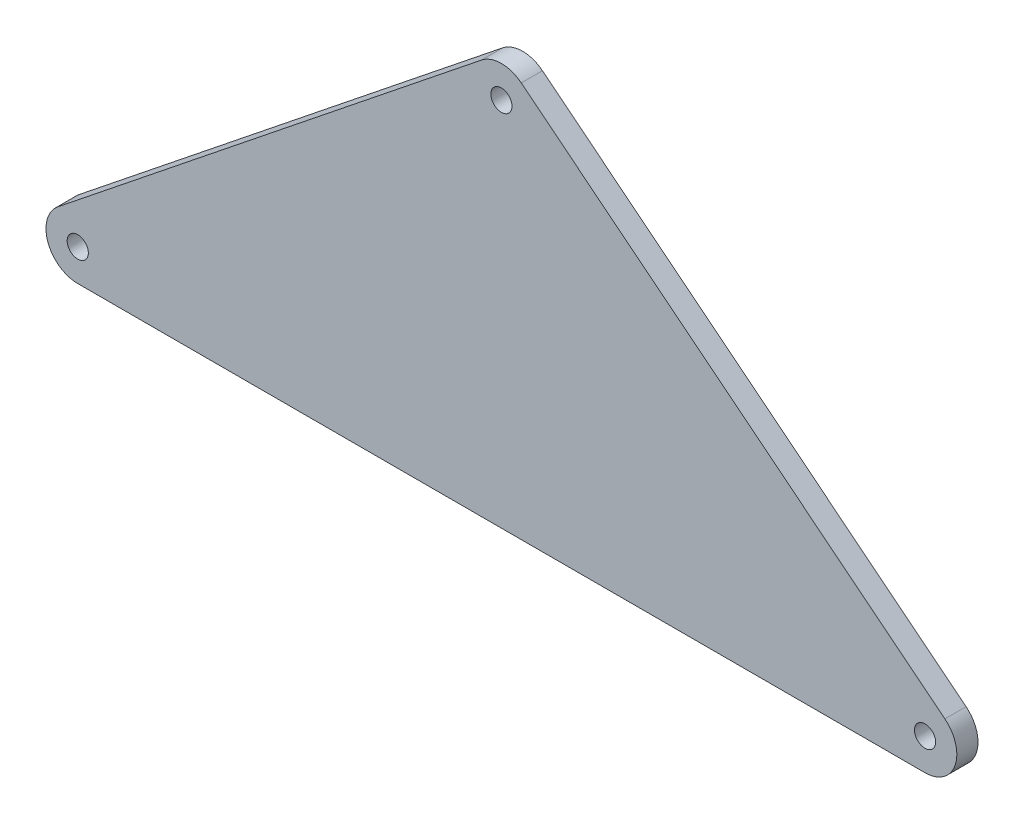
from build123d import *

# Parameters (mm, degrees)
SKETCH1_R           = 4.7625
SKETCH1_R_2         = 1.5875
BOSS_EXTRUDE1_DEPTH = 3.175


with BuildPart() as part:
    # Sketch1 → Boss-Extrude1 (new body)
    # profile 1 of 4: a face of its own
    with BuildSketch(Plane.XY):
        with BuildLine():
            ThreePointArc((68.2625, 50.8), (61.436938671, 46.507543337), (60.524889836, 54.518887705))
            Line((60.524889836, 54.518887705), (-2.975110164, 3.718887705))
            ThreePointArc((-2.975110164, 3.718887705), (2.063061329, 4.292456663), (4.7625, 0))
            ThreePointArc((4.7625, 0), (3.367596045, -3.367596045), (0, -4.7625))
            Line((0, -4.7625), (127, -4.7625))
            ThreePointArc((127, -4.7625), (122.50597013, 1.576420559), (129.975110164, 3.718887705))
            Line((129.975110164, 3.718887705), (66.475110164, 54.518887705))
            ThreePointArc((66.475110164, 54.518887705), (67.792456663, 52.863061329), (68.2625, 50.8))
        make_face()
    # profile 2 of 4: a face of its own
    with BuildSketch(Plane.XY):
        Circle(SKETCH1_R)
        with Locations(Location((0, 0, 0), (0, 0, 180))):
            Circle(SKETCH1_R_2, mode=Mode.SUBTRACT)
    # profile 3 of 4: a face of its own
    with BuildSketch(Plane.XY):
        with Locations((63.5, 50.8)):
            Circle(SKETCH1_R)
        with Locations(Location((63.5, 50.8, 0), (0, 0, 180))):
            Circle(SKETCH1_R_2, mode=Mode.SUBTRACT)
    # profile 4 of 4: a face of its own
    with BuildSketch(Plane.XY):
        with Locations((127, 0)):
            Circle(SKETCH1_R)
        with Locations(Location((127, 0, 0), (0, 0, 180))):
            Circle(SKETCH1_R_2, mode=Mode.SUBTRACT)
    extrude(amount=BOSS_EXTRUDE1_DEPTH)


solid = part.part
